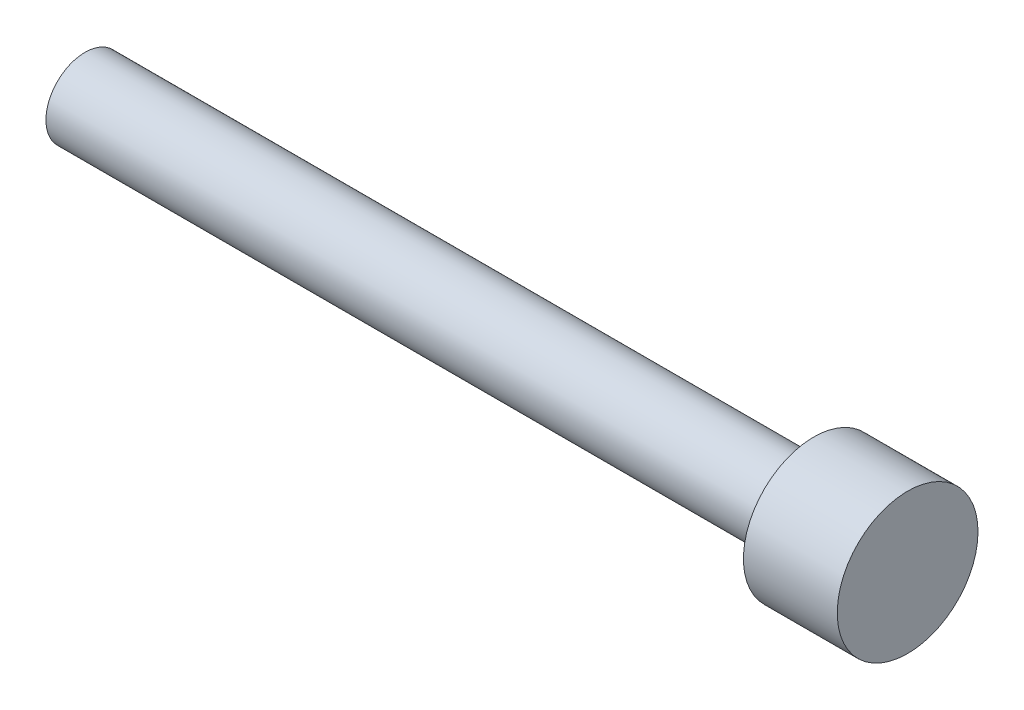
from build123d import *

# Parameters (mm, degrees)
SKETCH1_R           = 1.25
BOSS_EXTRUDE1_DEPTH = 11.65
SKETCH2_R           = 2.25
BOSS_EXTRUDE2_DEPTH = 3


with BuildPart() as part:
    # Sketch1 → Boss-Extrude1 (new, symmetric)
    with BuildSketch(Plane(origin=(0, 0, 0), x_dir=(0, 0, -1), z_dir=(1, 0, 0))):
        Circle(SKETCH1_R)
    extrude(amount=BOSS_EXTRUDE1_DEPTH, both=True)

    # Sketch2 → Boss-Extrude2 (add)
    with BuildSketch(Plane(origin=(11.65, 0, 0), x_dir=(0, 0, -1), z_dir=(1, 0, 0))):
        Circle(SKETCH2_R)
    extrude(amount=BOSS_EXTRUDE2_DEPTH)


solid = part.part
